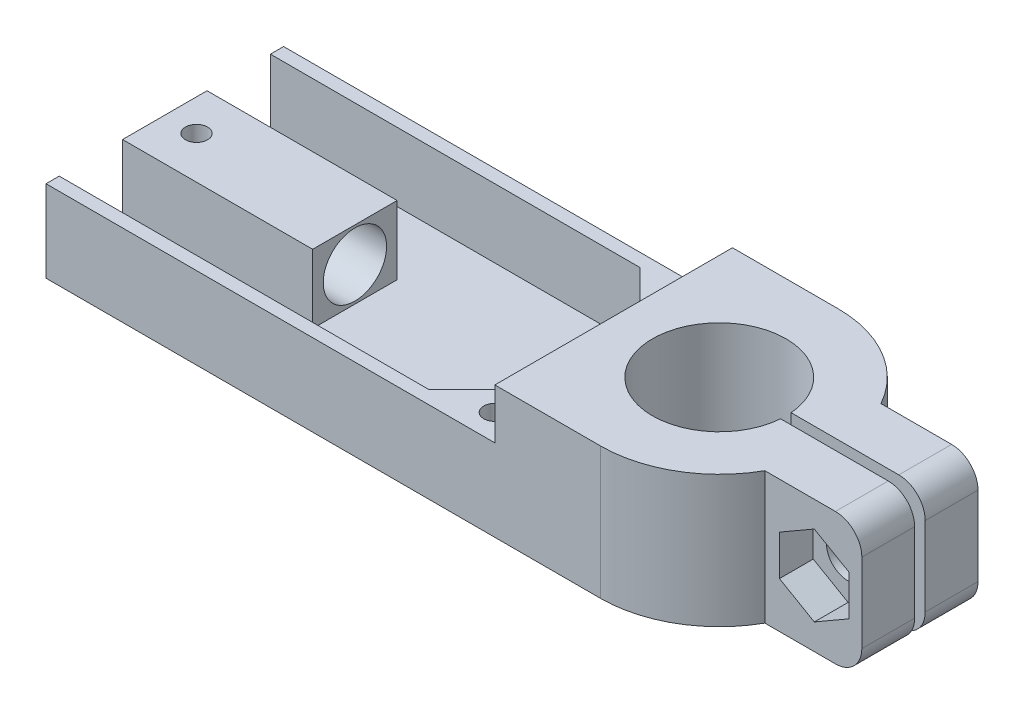
from build123d import *

# Parameters (mm, degrees)
BOSS_EXTRUDE1_DEPTH = 25
CUT_EXTRUDE1_DEPTH  = 85
SKETCH3_W           = 36
SKETCH3_H           = 16
BOSS_EXTRUDE2_DEPTH = 13
SKETCH4_R           = 6
CUT_EXTRUDE2_DEPTH  = 23
BOSS_EXTRUDE3_DEPTH = 13
CUT_EXTRUDE4_REACH  = 110.497
SKETCH7_R           = 2.1
CUT_EXTRUDE5_DEPTH  = 11.5
SKETCH10_R          = 4.1
CUT_EXTRUDE6_DEPTH  = 114.014379616
SKETCH11_R          = 4.1
CUT_EXTRUDE7_DEPTH  = 6.4
FILLET1_R           = 5


with BuildPart() as part:
    # Sketch1 → Boss-Extrude1 (new body)
    with BuildSketch(Plane(origin=(0, 0, 0), x_dir=(1, 0, 0), z_dir=(0, 1, 0))):
        with BuildLine():
            Line((0, -22.5), (-105, -22.5))
            Line((-105, -22.5), (-105, 22.5))
            Line((-105, 22.5), (0, 22.5))
            ThreePointArc((0, 22.5), (11.374313166, 19.413268658), (19.627786426, 11))
            Line((19.627786426, 11), (38, 11))
            Line((38, 11), (38, 1))
            Line((38, 1), (22, 1))
            Line((22, 1), (12.610412364, 1))
            ThreePointArc((12.610412364, 1), (-12.65, 0), (12.610412364, -1))
            Line((12.610412364, -1), (22, -1))
            Line((22, -1), (38, -1))
            Line((38, -1), (38, -11))
            Line((38, -11), (19.627786426, -11))
            ThreePointArc((19.627786426, -11), (11.374313166, -19.413268658), (0, -22.5))
        make_face()
    extrude(amount=BOSS_EXTRUDE1_DEPTH)

    # Sketch2 → Cut-Extrude1 (cut)
    with BuildSketch(Plane.ZY.offset(105)):
        Polygon((20, 25), (-20, 25), (-22.5, 25), (-22.5, 15.5), (-20, 15.5), (-20, 2.5), (20, 2.5), (20, 15.5), (22.5, 15.5), (22.5, 25), align=None)
    extrude(amount=-CUT_EXTRUDE1_DEPTH, mode=Mode.SUBTRACT)

    # Sketch3 → Boss-Extrude2 (add)
    with BuildSketch(Plane(origin=(0, 2.5, 0), x_dir=(1, 0, 0), z_dir=(0, 1, 0))):
        with Locations((-87, 0)):
            Rectangle(SKETCH3_W, SKETCH3_H)
    extrude(amount=BOSS_EXTRUDE2_DEPTH)

    # Sketch4 → Cut-Extrude2 (cut)
    with BuildSketch(Plane(origin=(-69, 0, 0), x_dir=(0, 0, -1), z_dir=(1, 0, 0))):
        with Locations((0, 9)):
            Circle(SKETCH4_R)
    extrude(amount=-CUT_EXTRUDE2_DEPTH, mode=Mode.SUBTRACT)

    # Sketch6 → Boss-Extrude3 (add)
    with BuildSketch(Plane(origin=(0, 2.5, 0), x_dir=(1, 0, 0), z_dir=(0, 1, 0))):
        Polygon((-35, -20), (-20, -5), (-20, -20), align=None)
        Polygon((-20, 20), (-20, 5), (-35, 20), align=None)
    extrude(amount=BOSS_EXTRUDE3_DEPTH)

    # Sketch7 → Cut-Extrude4 (cut, up to next)
    with BuildSketch(Plane(origin=(0, 15.5, 0), x_dir=(1, 0, 0), z_dir=(0, 1, 0)), mode=Mode.PRIVATE) as cut_extrude4_sk1:
        with Locations(Location((-25, -17.5, 0), (0, 0, 270))):
            Circle(SKETCH7_R)
    cut_extrude4_tool1 = extrude(cut_extrude4_sk1.sketch, amount=-CUT_EXTRUDE4_REACH, mode=Mode.PRIVATE) & part.part
    # Sketch7 → Cut-Extrude4 (cut, up to next)
    with BuildSketch(Plane(origin=(0, 15.5, 0), x_dir=(1, 0, 0), z_dir=(0, 1, 0)), mode=Mode.PRIVATE) as cut_extrude4_sk2:
        with Locations(Location((-25, 17.5, 0), (0, 0, 270))):
            Circle(SKETCH7_R)
    cut_extrude4_tool2 = extrude(cut_extrude4_sk2.sketch, amount=-CUT_EXTRUDE4_REACH, mode=Mode.PRIVATE) & part.part
    # Sketch7 → Cut-Extrude4 (cut, up to next)
    with BuildSketch(Plane(origin=(0, 15.5, 0), x_dir=(1, 0, 0), z_dir=(0, 1, 0)), mode=Mode.PRIVATE) as cut_extrude4_sk3:
        with Locations(Location((-99, 0, 0), (0, 0, 270))):
            Circle(SKETCH7_R)
    cut_extrude4_tool3 = extrude(cut_extrude4_sk3.sketch, amount=-CUT_EXTRUDE4_REACH, mode=Mode.PRIVATE) & part.part
    add(cut_extrude4_tool1.solids().sort_by_distance((-25, 15.5, 17.5))[0], mode=Mode.SUBTRACT)
    add(cut_extrude4_tool2.solids().sort_by_distance((-25, 15.5, -17.5))[0], mode=Mode.SUBTRACT)
    add(cut_extrude4_tool3.solids().sort_by_distance((-99, 15.5, 0))[0], mode=Mode.SUBTRACT)

    # Sketch8 → Cut-Extrude5 (cut)
    with BuildSketch(Plane(origin=(0, 0, 0), x_dir=(-1, 0, 0), z_dir=(0, -1, 0))):
        Polygon((20.843078062, 17.5), (22.921539031, 13.9), (27.078460969, 13.9), (29.156921938, 17.5), (27.078460969, 21.1), (22.921539031, 21.1), align=None)
        Polygon((20.843078062, -17.5), (22.921539031, -21.1), (27.078460969, -21.1), (29.156921938, -17.5), (27.078460969, -13.9), (22.921539031, -13.9), align=None)
        Polygon((99, -4.156921938), (102.6, -2.078460969), (102.6, 2.078460969), (99, 4.156921938), (95.4, 2.078460969), (95.4, -2.078460969), align=None)
    extrude(amount=-CUT_EXTRUDE5_DEPTH, mode=Mode.SUBTRACT)

    # Sketch10 → Cut-Extrude6 (cut, through all)
    with BuildSketch(Plane.XY.offset(11)):
        with Locations((29, 12.5)):
            Circle(SKETCH10_R)
    extrude(amount=-CUT_EXTRUDE6_DEPTH, mode=Mode.SUBTRACT)

    # Sketch11 → Cut-Extrude7 (cut)
    with BuildSketch(Plane(origin=(0, 0, 11), x_dir=(-1, 0, 0), z_dir=(0, 0, -1))):
        Polygon((-35.6, 16.310511777), (-35.6, 8.689488223), (-29, 4.878976447), (-22.4, 8.689488223), (-22.4, 16.310511777), (-29, 20.121023553), align=None)
        with Locations(Location((-29, 12.5, 0), (0, 0, 180))):
            Circle(SKETCH11_R, mode=Mode.SUBTRACT)
    extrude(amount=CUT_EXTRUDE7_DEPTH, mode=Mode.SUBTRACT)

    # Fillet1
    fillet1_edges = [part.edges().sort_by_distance(p)[0] for p in [
        (38, 25, 6),
        (38, 0, -6),
        (38, 0, 6),
        (38, 25, -6),
    ]]
    fillet(fillet1_edges, radius=FILLET1_R)


solid = part.part
